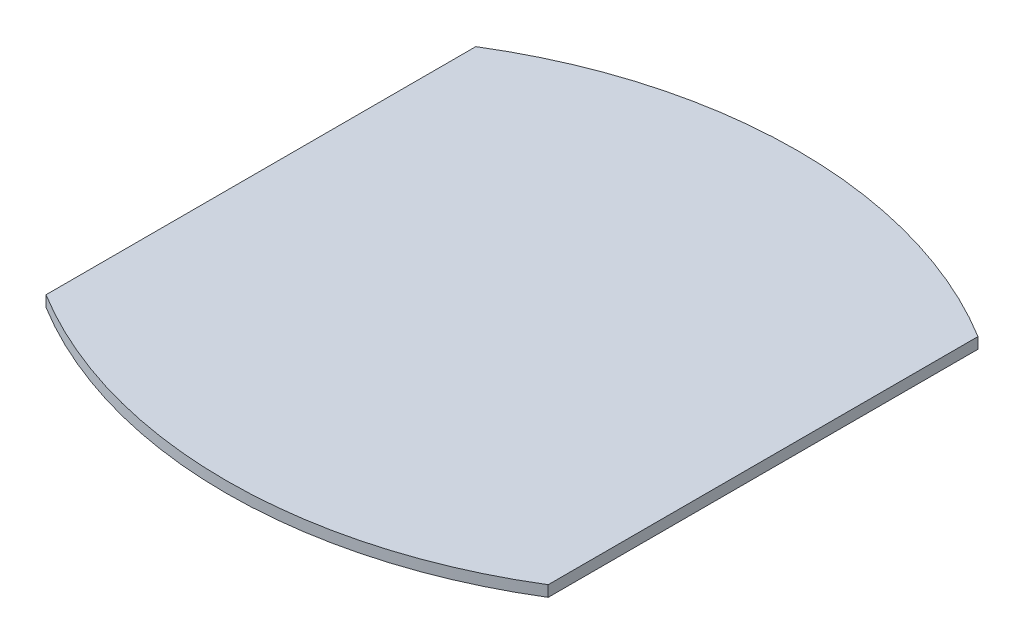
from build123d import *

# Parameters (mm, degrees)
BOSS_EXTRU_1_DEPTH = 6.35


with BuildPart() as part:
    # Esquisse1 → Boss.-Extru.1 (new body)
    with BuildSketch(Plane(origin=(0, 0, 0), x_dir=(1, 0, 0), z_dir=(0, 1, 0))):
        with BuildLine():
            Line((-145, -124.103571402), (-145, 124.103571402))
            ThreePointArc((-145, 124.103571402), (0, 165), (145, 124.103571402))
            Line((145, 124.103571402), (145, -124.103571402))
            ThreePointArc((145, -124.103571402), (0, -165), (-145, -124.103571402))
        make_face()
    extrude(amount=BOSS_EXTRU_1_DEPTH)


solid = part.part
